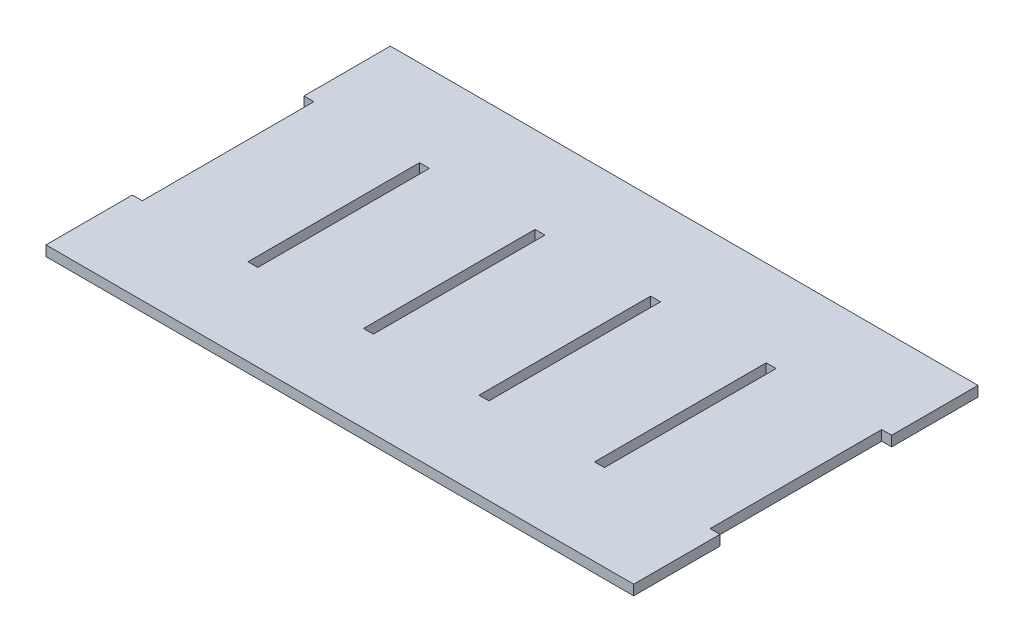
from build123d import *

# Parameters (mm, degrees)
SKETCH1_W           = 173.4
SKETCH1_H           = 101.6
BOSS_EXTRUDE1_DEPTH = 3
SKETCH2_W           = 2.92
SKETCH2_H           = 50.64
CUT_EXTRUDE1_DEPTH  = 3
LPATTERN1_COUNT     = 6
LPATTERN1_PITCH     = 34.096


with BuildPart() as part:
    # Sketch1 → Boss-Extrude1 (new body)
    with BuildSketch(Plane(origin=(0, 0, 0), x_dir=(1, 0, 0), z_dir=(0, 1, 0))):
        with Locations((86.7, 50.8)):
            Rectangle(SKETCH1_W, SKETCH1_H)
    extrude(amount=BOSS_EXTRUDE1_DEPTH)

    # Sketch2 → Cut-Extrude1 (cut)
    with BuildSketch(Plane(origin=(0, 3, 0), x_dir=(1, 0, 0), z_dir=(0, 1, 0))):
        with Locations((1.46, 50.8)):
            Rectangle(SKETCH2_W, SKETCH2_H)
    cut_extrude1 = extrude(amount=-CUT_EXTRUDE1_DEPTH, mode=Mode.SUBTRACT)

    # LPattern1: Cut-Extrude1 ×6
    with Locations(*[(i * LPATTERN1_PITCH, 0, 0) for i in range(1, LPATTERN1_COUNT)]):
        add(cut_extrude1, mode=Mode.SUBTRACT)


solid = part.part
